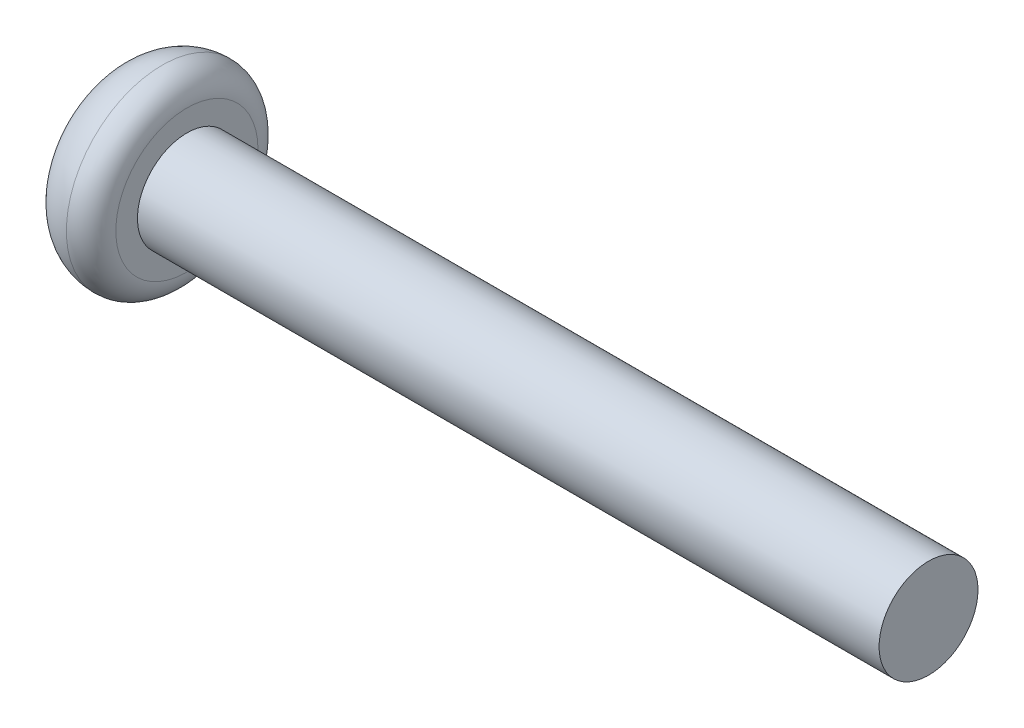
from build123d import *

# Parameters (mm, degrees)
SKETCH2_W          = 2.85
SKETCH2_H          = 2.85
CUT_EXTRUDE1_DEPTH = 2.5


with BuildPart() as part:
    # Sketch1 → Revolve1 (revolve)
    with BuildSketch(Plane.XY, mode=Mode.PRIVATE) as revolve1_sk:
        with BuildLine():
            Line((0, 0), (33, 0))
            Line((33, 0), (33, 2))
            Line((33, 2), (3, 2))
            Line((3, 2), (3, 2.875))
            ThreePointArc((3, 2.875), (2.707106781, 3.582106781), (2, 3.875))
            ThreePointArc((2, 3.875), (0.585786438, 3.289213562), (0, 1.875))
            Line((0, 1.875), (0, 0))
        make_face()
    revolve(revolve1_sk.sketch.rotate(Axis((0, 0, 0), (-1, 0, 0)), 90), axis=Axis((0, 0, 0), (-1, 0, 0)))

    # Sketch2 → Cut-Extrude1 (cut)
    with BuildSketch(Plane.ZY):
        Rectangle(SKETCH2_W, SKETCH2_H)
    extrude(amount=-CUT_EXTRUDE1_DEPTH, mode=Mode.SUBTRACT)


solid = part.part
